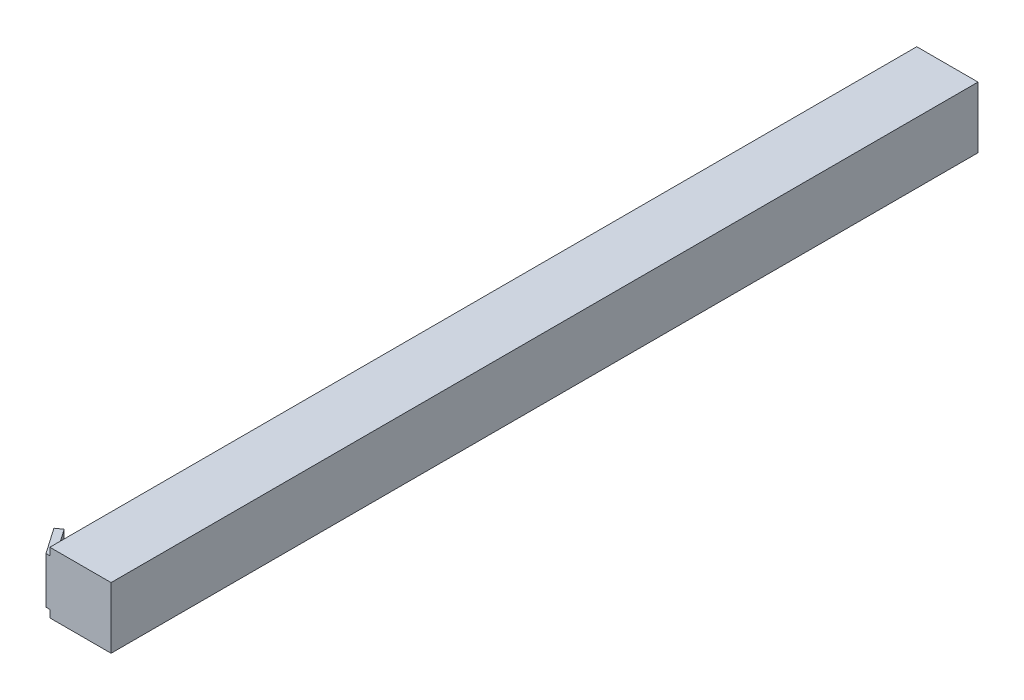
from build123d import *

# Parameters (mm, degrees)
SKETCH1_W           = 16.6
SKETCH1_H           = 235
BOSS_EXTRUDE1_DEPTH = 2
SKETCH1_6_W         = 2
SKETCH1_6_H         = 214
BOSS_EXTRUDE3_DEPTH = 12.6
SKETCH3_W           = 16.6
SKETCH3_H           = 235
BOSS_EXTRUDE4_DEPTH = 2
SKETCH4_W           = 214
SKETCH4_H           = 8.6
CUT_EXTRUDE1_DEPTH  = 4
CUT_EXTRUDE2_DEPTH  = 4


with BuildPart() as part:
    # Sketch1 → Boss-Extrude1 (new body)
    with BuildSketch(Plane(origin=(0, 0, 0), x_dir=(1, 0, 0), z_dir=(0, 1, 0))):
        with Locations((8.3, 115.5)):
            Rectangle(SKETCH1_W, SKETCH1_H)
    extrude(amount=-BOSS_EXTRUDE1_DEPTH)

    # Sketch1<6> → Boss-Extrude3 (add)
    with BuildSketch(Plane(origin=(0, 0, 0), x_dir=(1, 0, 0), z_dir=(0, 1, 0))):
        with BuildLine():
            Line((-1.045606528, -2), (16.6, -2))
            Line((16.6, -2), (16.6, 233))
            Line((16.6, 233), (14.6, 233))
            Line((14.6, 233), (14.6, 14.47143967))
            ThreePointArc((14.6, 14.47143967), (10.315894346, 4.193033104), (0, 0))
            Line((0, 0), (-4.280197972, 6.15872595))
            Line((-4.280197972, 6.15872595), (-5.922524892, 5.017339824))
            Line((-5.922524892, 5.017339824), (-1.045606528, -2))
        make_face()
        with Locations((1, 126)):
            Rectangle(SKETCH1_6_W, SKETCH1_6_H)
    extrude(amount=BOSS_EXTRUDE3_DEPTH)

    # Sketch3 → Boss-Extrude4 (add)
    with BuildSketch(Plane(origin=(0, 12.6, 0), x_dir=(1, 0, 0), z_dir=(0, 1, 0))):
        with Locations((8.3, 115.5)):
            Rectangle(SKETCH3_W, SKETCH3_H)
    extrude(amount=BOSS_EXTRUDE4_DEPTH)

    # Sketch4 → Cut-Extrude1 (cut)
    with BuildSketch(Plane.ZY):
        with Locations((-126, 6.3)):
            Rectangle(SKETCH4_W, SKETCH4_H)
    extrude(amount=-CUT_EXTRUDE1_DEPTH, mode=Mode.SUBTRACT)

    # Sketch6 → Cut-Extrude2 (cut)
    with BuildSketch(Plane.ZY):
        with BuildLine():
            ThreePointArc((-20.999, 2), (-19.585493544, 1.414506456), (-19, 0.001))
            Line((-19, 0.001), (-19, 2))
            Line((-19, 2), (-20.999, 2))
        make_face()
        with BuildLine():
            Line((-19, 10.6), (-19, 12.599))
            ThreePointArc((-19, 12.599), (-19.585493544, 11.185493544), (-20.999, 10.6))
            Line((-20.999, 10.6), (-19, 10.6))
        make_face()
    extrude(amount=-CUT_EXTRUDE2_DEPTH, mode=Mode.SUBTRACT)


solid = part.part
